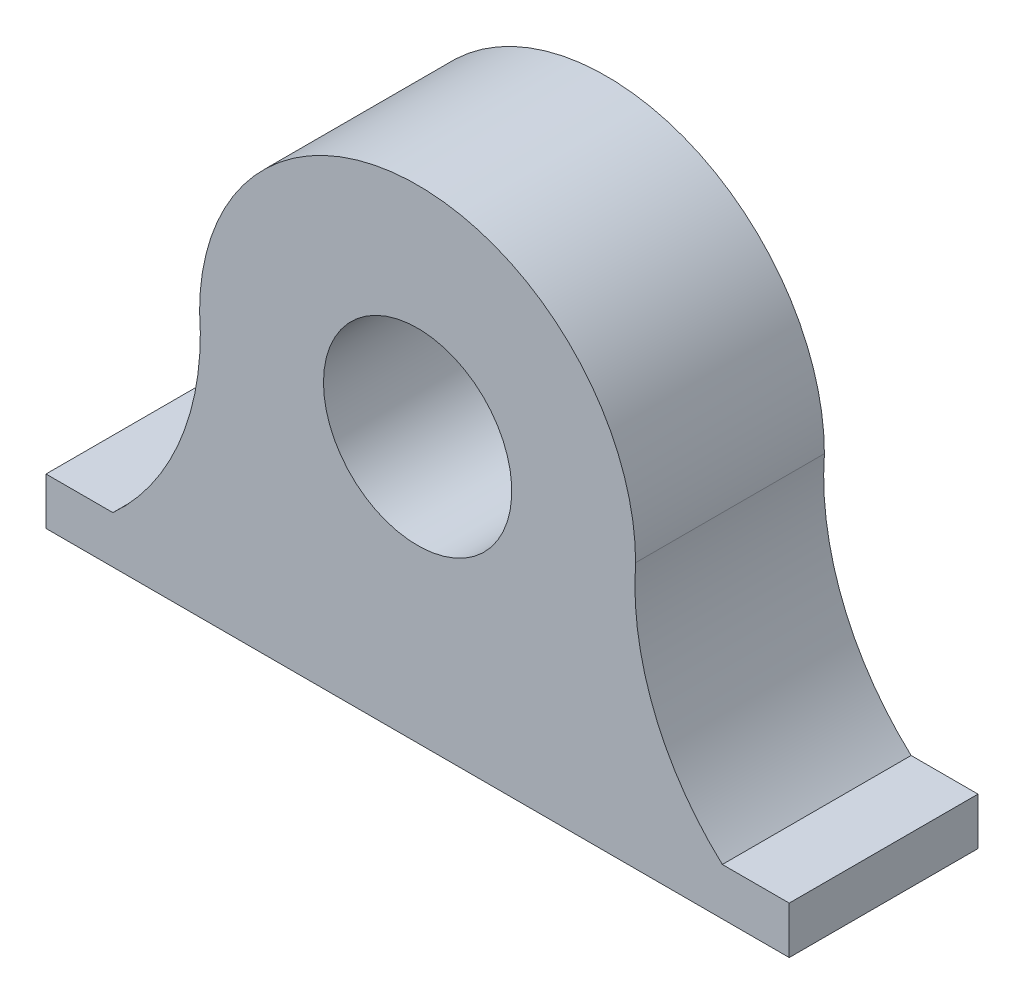
from build123d import *

# Parameters (mm, degrees)
CROQUIS1_R              = 19
SALIENTE_EXTRUIR1_DEPTH = 38.1


with BuildPart() as part:
    # Croquis1 → Saliente-Extruir1 (new body)
    with BuildSketch(Plane.XY):
        with BuildLine():
            Line((-61.503424818, -44), (-75, -44))
            Line((-75, -44), (-75, -53.525))
            Line((-75, -53.525), (75, -53.525))
            Line((75, -53.525), (75, -44))
            Line((75, -44), (61.503424818, -44))
            ThreePointArc((61.503424818, -44), (48.377816196, -25.671153051), (43.853638254, -3.585862786))
            ThreePointArc((43.853638254, -3.585862786), (43.897102733, -1.791718479), (44, 0))
            ThreePointArc((44, 0), (0, 44), (-44, 0))
            ThreePointArc((-44, 0), (-43.897102733, -1.791718479), (-43.853638254, -3.585862786))
            ThreePointArc((-43.853638254, -3.585862786), (-48.377816196, -25.671153051), (-61.503424818, -44))
        make_face()
        with Locations(Location((0, 0, 0), (0, 0, 180))):
            Circle(CROQUIS1_R, mode=Mode.SUBTRACT)
    extrude(amount=SALIENTE_EXTRUIR1_DEPTH)


solid = part.part
